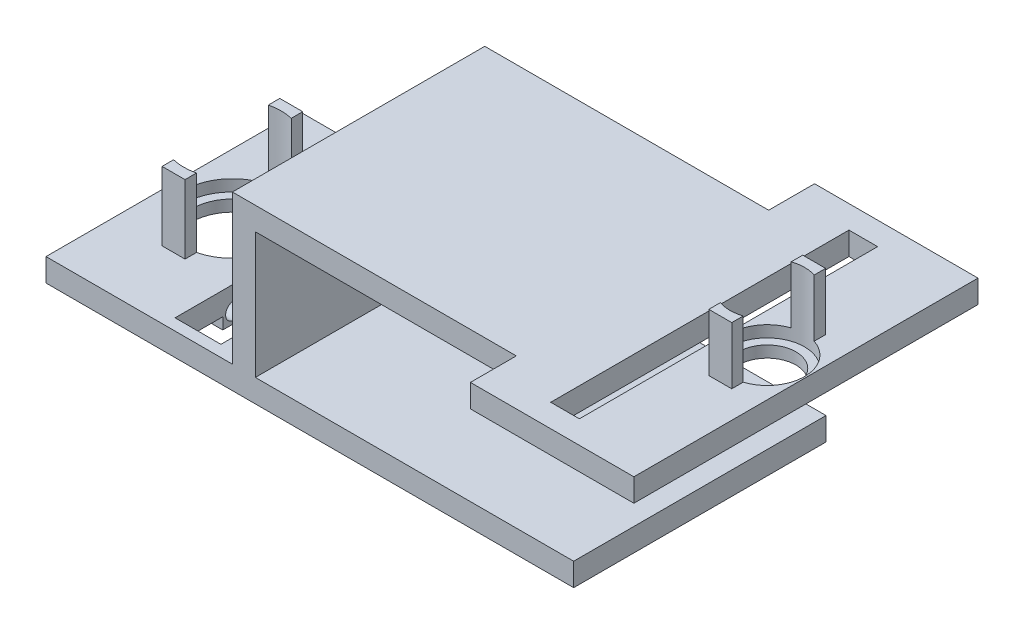
from build123d import *
from build123d.topology import SkipClean

# Parameters (mm, degrees)
SKETCH1_W           = 46
SKETCH1_H           = 2
BOSS_EXTRUDE1_DEPTH = 22
SKETCH2_W           = 29.75
SKETCH2_H           = 22
BOSS_EXTRUDE2_DEPTH = 13
SKETCH3_W           = 27.75
SKETCH3_H           = 11
CUT_EXTRUDE1_DEPTH  = 22
SKETCH4_R           = 4.25
CUT_EXTRUDE2_DEPTH  = 1
SKETCH5_R           = 3.5
CUT_EXTRUDE3_DEPTH  = 1
BOSS_EXTRUDE4_START = 6
BOSS_EXTRUDE4_DEPTH = 6
SKETCH20_W          = 11
SKETCH20_H          = 2
BOSS_EXTRUDE8_DEPTH = 3
SKETCH6_W           = 4
SKETCH6_H           = 20
CUT_EXTRUDE4_DEPTH  = 35.380226875
SKETCH25_W          = 2
SKETCH25_H          = 1.75
CUT_EXTRUDE7_DEPTH  = 47.707199659
SKETCH26_R          = 0.75
CUT_EXTRUDE8_DEPTH  = 13
BOSS_EXTRUDE3_DEPTH = 2
SKETCH13_R          = 3.25
CUT_EXTRUDE5_DEPTH  = 1
SKETCH14_R          = 2.5
CUT_EXTRUDE6_DEPTH  = 1
BOSS_EXTRUDE6_START = 5
BOSS_EXTRUDE6_DEPTH = 5


with BuildPart() as part:
    # Sketch1 → Boss-Extrude1 (new body)
    with BuildSketch(Plane.XY):
        Rectangle(SKETCH1_W, SKETCH1_H)
    extrude(amount=-BOSS_EXTRUDE1_DEPTH)

    # Sketch2 → Boss-Extrude2 (add)
    with BuildSketch(Plane(origin=(0, 1, 0), x_dir=(1, 0, 0), z_dir=(0, 1, 0))):
        with Locations((8.125, 11)):
            Rectangle(SKETCH2_W, SKETCH2_H)
    extrude(amount=BOSS_EXTRUDE2_DEPTH)

    # Sketch3 → Cut-Extrude1 (cut)
    with BuildSketch(Plane.XY):
        with Locations((9.125, 6.5)):
            Rectangle(SKETCH3_W, SKETCH3_H)
    extrude(amount=-CUT_EXTRUDE1_DEPTH, mode=Mode.SUBTRACT)

    # Sketch4 → Cut-Extrude2 (cut)
    with BuildSketch(Plane(origin=(0, 1, 0), x_dir=(1, 0, 0), z_dir=(0, 1, 0))):
        with Locations(Location((-17.75, 11, 0), (0, 0, 180))):
            Circle(SKETCH4_R)
    extrude(amount=-CUT_EXTRUDE2_DEPTH, mode=Mode.SUBTRACT)

    # Sketch5 → Cut-Extrude3 (cut)
    with BuildSketch(Plane(origin=(0, 0, 0), x_dir=(1, 0, 0), z_dir=(0, 1, 0))):
        with Locations(Location((-17.75, 11, 0), (0, 0, 180))):
            Circle(SKETCH5_R)
    extrude(amount=-CUT_EXTRUDE3_DEPTH, mode=Mode.SUBTRACT)

    # Sketch16 → Boss-Extrude4 (add)
    with SkipClean():  # the faces are left unmerged after this step: merging them gives an invalid solid
        with BuildSketch(Plane(origin=(0, 1, 0), x_dir=(1, 0, 0), z_dir=(0, 1, 0)).offset(BOSS_EXTRUDE4_START)):
            with BuildLine():
                Line((-18.75, 6.86932209), (-18.75, 5.86932209))
                Line((-18.75, 5.86932209), (-16.75, 5.86932209))
                Line((-16.75, 5.86932209), (-16.75, 6.86932209))
                ThreePointArc((-16.75, 6.86932209), (-17.75, 6.75), (-18.75, 6.86932209))
            make_face()
        boss_extrude4 = extrude(amount=-BOSS_EXTRUDE4_DEPTH)

    # Sketch20 → Boss-Extrude8 (add)
    with SkipClean():  # the faces are left unmerged after this step: merging them gives an invalid solid
        with BuildSketch(Plane(origin=(0, 1, 0), x_dir=(1, 0, 0), z_dir=(0, 1, 0))):
            with Locations((-10.25, 15.84)):
                Rectangle(SKETCH20_W, SKETCH20_H)
        boss_extrude8 = extrude(amount=-BOSS_EXTRUDE8_DEPTH)

    # Sketch6 → Cut-Extrude4 (cut, through all)
    with SkipClean():  # the faces are left unmerged after this step: merging them gives an invalid solid
        with BuildSketch(Plane(origin=(0, 1, 0), x_dir=(1, 0, 0), z_dir=(0, 1, 0))):
            with Locations((-10.75, 11)):
                Rectangle(SKETCH6_W, SKETCH6_H)
        cut_extrude4 = extrude(amount=-CUT_EXTRUDE4_DEPTH, mode=Mode.SUBTRACT)

    # Sketch25 → Cut-Extrude7 (cut, through all)
    with SkipClean():  # the faces are left unmerged after this step: merging them gives an invalid solid
        with BuildSketch(Plane.ZY.offset(15.75)):
            with Locations((-15.84, -1.125)):
                Rectangle(SKETCH25_W, SKETCH25_H)
        cut_extrude7 = extrude(amount=CUT_EXTRUDE7_DEPTH, mode=Mode.SUBTRACT)

    # Sketch26 → Cut-Extrude8 (cut)
    with SkipClean():  # the faces are left unmerged after this step: merging them gives an invalid solid
        with BuildSketch(Plane.ZY.offset(15.75)):
            with Locations(Location((-15.84, -1, 0), (0, 0, 270))):
                Circle(SKETCH26_R)
        cut_extrude8 = extrude(amount=-CUT_EXTRUDE8_DEPTH, mode=Mode.SUBTRACT)

    # Mirror8: Boss-Extrude4, Boss-Extrude8, Cut-Extrude4, Cut-Extrude7, Cut-Extrude8 across plane
    with SkipClean():  # the faces are left unmerged after this step: merging them gives an invalid solid
        add(boss_extrude4.mirror(Plane.XY.offset(-11)))
        add(boss_extrude8.mirror(Plane.XY.offset(-11)))
        add(cut_extrude4.mirror(Plane.XY.offset(-11)), mode=Mode.SUBTRACT)
        add(cut_extrude7.mirror(Plane.XY.offset(-11)), mode=Mode.SUBTRACT)
        add(cut_extrude8.mirror(Plane.XY.offset(-11)), mode=Mode.SUBTRACT)

    # Sketch12 → Boss-Extrude3 (add)
    with SkipClean():  # the faces are left unmerged after this step: merging them gives an invalid solid
        with BuildSketch(Plane(origin=(0, 14, 0), x_dir=(1, 0, 0), z_dir=(0, 1, 0))):
            Polygon((23, 22), (18, 22), (18, 26), (32.25, 26), (32.25, 11), (25.5, 11), (25.5, 24), (23, 24), align=None)
        boss_extrude3 = extrude(amount=-BOSS_EXTRUDE3_DEPTH)

    # Sketch13 → Cut-Extrude5 (cut)
    with SkipClean():  # the faces are left unmerged after this step: merging them gives an invalid solid
        with BuildSketch(Plane(origin=(0, 14, 0), x_dir=(1, 0, 0), z_dir=(0, 1, 0))):
            with Locations((28.875, 11)):
                Circle(SKETCH13_R)
        cut_extrude5 = extrude(amount=-CUT_EXTRUDE5_DEPTH, mode=Mode.SUBTRACT)

    # Sketch14 → Cut-Extrude6 (cut)
    with SkipClean():  # the faces are left unmerged after this step: merging them gives an invalid solid
        with BuildSketch(Plane(origin=(0, 13, 0), x_dir=(1, 0, 0), z_dir=(0, 1, 0))):
            with Locations((28.875, 11)):
                Circle(SKETCH14_R)
        cut_extrude6 = extrude(amount=-CUT_EXTRUDE6_DEPTH, mode=Mode.SUBTRACT)

    # Sketch18 → Boss-Extrude6 (add)
    with SkipClean():  # the faces are left unmerged after this step: merging them gives an invalid solid
        with BuildSketch(Plane(origin=(0, 14, 0), x_dir=(1, 0, 0), z_dir=(0, 1, 0)).offset(BOSS_EXTRUDE6_START)):
            with BuildLine():
                Line((29.875, 14.092329219), (29.875, 15.092329219))
                Line((29.875, 15.092329219), (27.875, 15.092329219))
                Line((27.875, 15.092329219), (27.875, 14.092329219))
                ThreePointArc((27.875, 14.092329219), (28.875, 14.25), (29.875, 14.092329219))
            make_face()
        boss_extrude6 = extrude(amount=-BOSS_EXTRUDE6_DEPTH)

    # Mirror3: Boss-Extrude3, Cut-Extrude5, Cut-Extrude6, Boss-Extrude6 across plane
    with SkipClean():  # the faces are left unmerged after this step: merging them gives an invalid solid
        add(boss_extrude3.mirror(Plane.XY.offset(-11)))
        add(cut_extrude5.mirror(Plane.XY.offset(-11)), mode=Mode.SUBTRACT)
        add(cut_extrude6.mirror(Plane.XY.offset(-11)), mode=Mode.SUBTRACT)
        add(boss_extrude6.mirror(Plane.XY.offset(-11)))


solid = part.part
